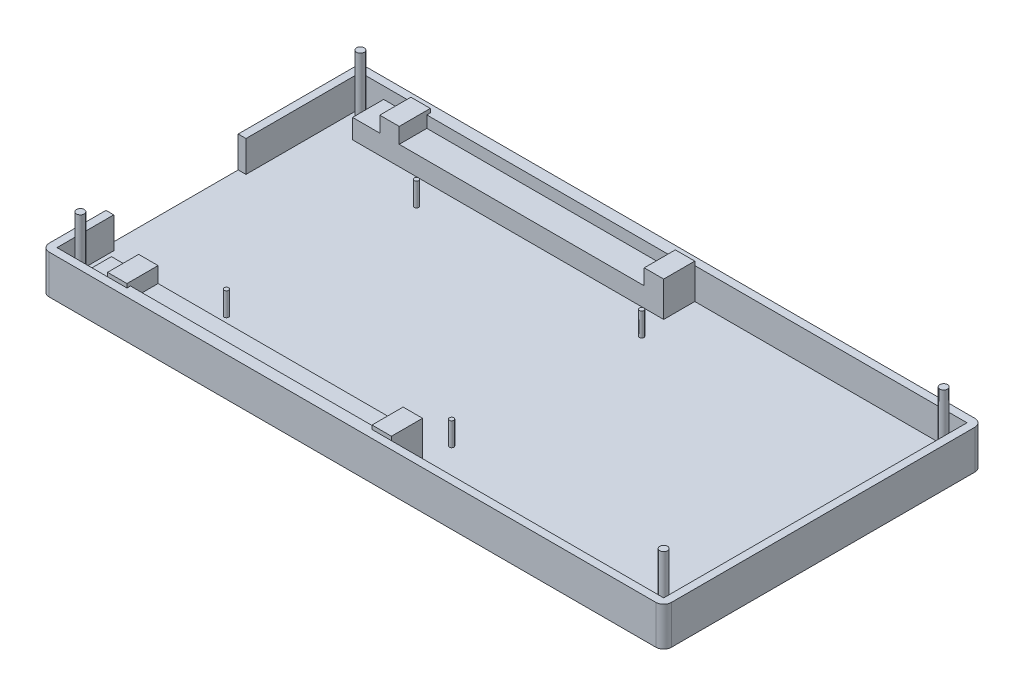
from build123d import *

# Parameters (mm, degrees)
SKETCH1_W           = 160
SKETCH1_H           = 82
BOSS_EXTRUDE1_DEPTH = 10
SHELL1_T            = -2
SKETCH2_R           = 1
BOSS_EXTRUDE2_DEPTH = 16
FILLET1_R           = 2
FILLET2_R           = 2
FILLET3_R           = 2
FILLET4_R           = 2
SKETCH7_R           = 0.575
BOSS_EXTRUDE3_DEPTH = 6
SKETCH10_W          = 34
SKETCH10_H          = 8.029729716
CUT_EXTRUDE1_DEPTH  = 6
SKETCH16_W          = 80
SKETCH16_H          = 8
BOSS_EXTRUDE5_DEPTH = 5
SKETCH18_W          = 5
SKETCH18_H          = 8
BOSS_EXTRUDE6_DEPTH = 4
SKETCH21_W          = 63
SKETCH21_H          = 3
BOSS_EXTRUDE7_DEPTH = 0.9
SKETCH22_W          = 63
SKETCH22_H          = 3
BOSS_EXTRUDE8_DEPTH = 0.9


with BuildPart() as part:
    # Sketch1 → Boss-Extrude1 (new body)
    with BuildSketch(Plane(origin=(0, 0, 0), x_dir=(1, 0, 0), z_dir=(0, 1, 0))):
        Rectangle(SKETCH1_W, SKETCH1_H)
    extrude(amount=BOSS_EXTRUDE1_DEPTH)

    # Shell1
    shell1_openings = [part.faces().sort_by_distance(p)[0] for p in [
        (0, 10, 0),
    ]]
    offset(amount=SHELL1_T, openings=shell1_openings, kind=Kind.INTERSECTION)

    # Sketch2 → Boss-Extrude2 (add)
    with BuildSketch(Plane(origin=(0, 2, 0), x_dir=(1, 0, 0), z_dir=(0, 1, 0))):
        with Locations(Location((-75, 36, 0), (0, 0, 90))):
            Circle(SKETCH2_R)
        with Locations(Location((75, 36, 0), (0, 0, 90))):
            Circle(SKETCH2_R)
        with Locations(Location((75, -36, 0), (0, 0, 90))):
            Circle(SKETCH2_R)
        with Locations(Location((-75, -36, 0), (0, 0, 90))):
            Circle(SKETCH2_R)
    extrude(amount=BOSS_EXTRUDE2_DEPTH)

    # Fillet1
    fillet1_edges = [part.edges().sort_by_distance(p)[0] for p in [
        (-80, 5, 41),
    ]]
    fillet(fillet1_edges, radius=FILLET1_R)

    # Fillet2
    fillet2_edges = [part.edges().sort_by_distance(p)[0] for p in [
        (-80, 5, -41),
    ]]
    fillet(fillet2_edges, radius=FILLET2_R)

    # Fillet3
    fillet3_edges = [part.edges().sort_by_distance(p)[0] for p in [
        (80, 5, -41),
    ]]
    fillet(fillet3_edges, radius=FILLET3_R)

    # Fillet4
    fillet4_edges = [part.edges().sort_by_distance(p)[0] for p in [
        (80, 5, 41),
    ]]
    fillet(fillet4_edges, radius=FILLET4_R)

    # Sketch7 → Boss-Extrude3 (add)
    with BuildSketch(Plane(origin=(0, 2, 0), x_dir=(1, 0, 0), z_dir=(0, 1, 0))):
        with Locations(Location((-49, 24.45, 0), (0, 0, 90))):
            Circle(SKETCH7_R)
        with Locations(Location((-49, -24.43, 0), (0, 0, 90))):
            Circle(SKETCH7_R)
        with Locations(Location((8.9, -24.43, 0), (0, 0, 90))):
            Circle(SKETCH7_R)
        with Locations(Location((8.9, 24.45, 0), (0, 0, 90))):
            Circle(SKETCH7_R)
    extrude(amount=BOSS_EXTRUDE3_DEPTH)

    # Sketch10 → Cut-Extrude1 (cut)
    with BuildSketch(Plane.ZY.offset(80)):
        with Locations((7.4, 6.014864858)):
            Rectangle(SKETCH10_W, SKETCH10_H)
    extrude(amount=-CUT_EXTRUDE1_DEPTH, mode=Mode.SUBTRACT)

    # Sketch16 → Boss-Extrude5 (add)
    with BuildSketch(Plane(origin=(0, 2, 0), x_dir=(1, 0, 0), z_dir=(0, 1, 0))):
        with Locations((-32, 35)):
            Rectangle(SKETCH16_W, SKETCH16_H)
        with Locations((-32, -35)):
            Rectangle(SKETCH16_W, SKETCH16_H)
    extrude(amount=BOSS_EXTRUDE5_DEPTH)

    # Sketch18 → Boss-Extrude6 (add)
    with BuildSketch(Plane(origin=(0, 7, 0), x_dir=(1, 0, 0), z_dir=(0, 1, 0))):
        with Locations((-62.5, 35)):
            Rectangle(SKETCH18_W, SKETCH18_H)
        with Locations((5.5, 35)):
            Rectangle(SKETCH18_W, SKETCH18_H)
        with Locations((5.5, -35)):
            Rectangle(SKETCH18_W, SKETCH18_H)
        with Locations((-62.5, -35)):
            Rectangle(SKETCH18_W, SKETCH18_H)
    extrude(amount=BOSS_EXTRUDE6_DEPTH)

    # Sketch21 → Boss-Extrude7 (add)
    with BuildSketch(Plane.XY.offset(-39)):
        with Locations((-28.5, 8.5)):
            Rectangle(SKETCH21_W, SKETCH21_H)
    extrude(amount=BOSS_EXTRUDE7_DEPTH)

    # Sketch22 → Boss-Extrude8 (add)
    with BuildSketch(Plane(origin=(0, 0, 39), x_dir=(-1, 0, 0), z_dir=(0, 0, -1))):
        with Locations((28.5, 8.5)):
            Rectangle(SKETCH22_W, SKETCH22_H)
    extrude(amount=BOSS_EXTRUDE8_DEPTH)


solid = part.part
